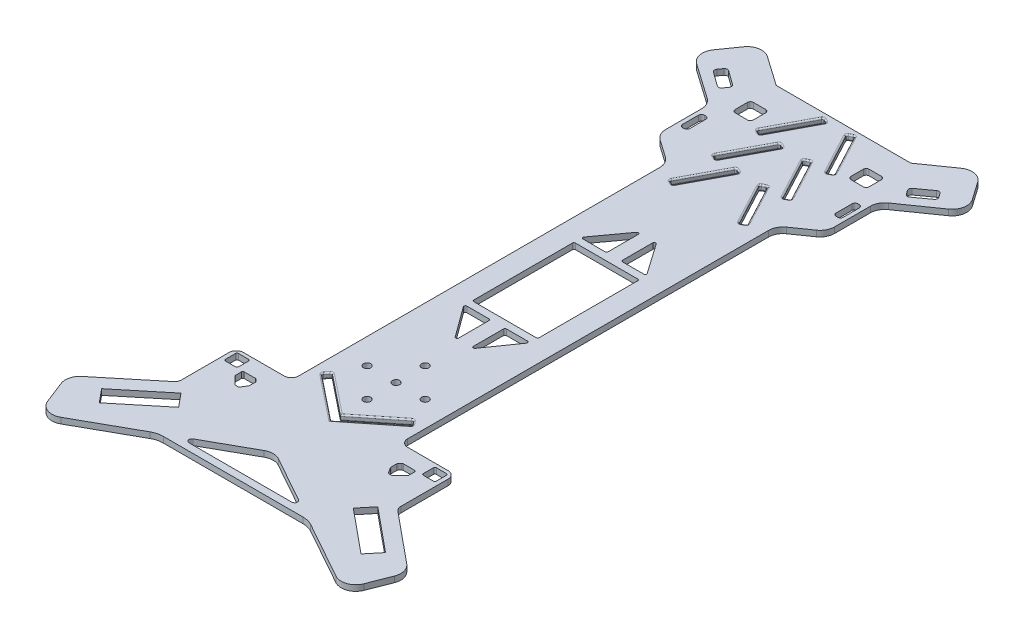
from build123d import *

# Parameters (mm, degrees)
SKETCH2_R           = 2.5
BOSS_EXTRUDE1_DEPTH = 4
FILLET1_R           = 1
CUT_EXTRUDE1_DEPTH  = 383.875992858
FILLET3_R           = 1


with BuildPart() as part:
    # Sketch2 → Boss-Extrude1 (new body)
    with BuildSketch(Plane(origin=(0, 0, 0), x_dir=(1, 0, 0), z_dir=(0, 1, 0))):
        with BuildLine():
            Line((-46.361864593, 80.672065662), (46.361864593, 80.672065662))
            Line((46.361864593, 80.672065662), (66.733304285, 94.936301299))
            ThreePointArc((66.733304285, 94.936301299), (74.205550425, 96.592858386), (80.660589091, 92.480545219))
            Line((80.660589091, 92.480545219), (89.264235636, 80.193264555))
            ThreePointArc((89.264235636, 80.193264555), (90.920792724, 72.721018415), (86.808479557, 66.265979749))
            Line((86.808479557, 66.265979749), (62.402393643, 49.176654414))
            ThreePointArc((62.402393643, 49.176654414), (59.268049675, 45.602620103), (58.138158007, 40.985133971))
            Line((58.138158007, 40.985133971), (58.138158007, 16.396474982))
            ThreePointArc((58.138158007, 16.396474982), (57.008266339, 11.77898885), (53.873922371, 8.204954539))
            Line((53.873922371, 8.204954539), (41.764235636, -0.274339397))
            ThreePointArc((41.764235636, -0.274339397), (38.629891668, -3.848373708), (37.5, -8.46585984))
            Line((37.5, -8.46585984), (37.5, -257.191548927))
            ThreePointArc((37.5, -257.191548927), (38.964466094, -260.727082833), (42.5, -262.191548927))
            Line((42.5, -262.191548927), (70.5, -262.191548927))
            ThreePointArc((70.5, -262.191548927), (74.035533906, -263.656015021), (75.5, -267.191548927))
            Line((75.5, -267.191548927), (75.5, -299.829610513))
            ThreePointArc((75.5, -299.829610513), (75.979045641, -301.965253667), (77.324388672, -303.691668603))
            Line((77.324388672, -303.691668603), (111.897825306, -332.119981805))
            ThreePointArc((111.897825306, -332.119981805), (115.222893786, -337.320332967), (114.861321217, -343.482231854))
            Line((114.861321217, -343.482231854), (108.940668871, -358.640885258))
            ThreePointArc((108.940668871, -358.640885258), (103.003554679, -364.415072502), (94.749722622, -363.73329568))
            Line((94.749722622, -363.73329568), (55.387093972, -341.748281553))
            ThreePointArc((55.387093972, -341.748281553), (51.851823332, -340.327947558), (48.072752447, -339.844097986))
            Line((48.072752447, -339.844097986), (-48.072752447, -339.844097986))
            ThreePointArc((-48.072752447, -339.844097986), (-51.851823332, -340.327947558), (-55.387093972, -341.748281553))
            Line((-55.387093972, -341.748281553), (-94.749722622, -363.73329568))
            ThreePointArc((-94.749722622, -363.73329568), (-103.003554679, -364.415072502), (-108.940668871, -358.640885258))
            Line((-108.940668871, -358.640885258), (-114.861321217, -343.482231854))
            ThreePointArc((-114.861321217, -343.482231854), (-115.222893786, -337.320332967), (-111.897825306, -332.119981805))
            Line((-111.897825306, -332.119981805), (-77.324388672, -303.691668603))
            ThreePointArc((-77.324388672, -303.691668603), (-75.979045641, -301.965253667), (-75.5, -299.829610513))
            Line((-75.5, -299.829610513), (-75.5, -267.191548927))
            ThreePointArc((-75.5, -267.191548927), (-74.035533906, -263.656015021), (-70.5, -262.191548927))
            Line((-70.5, -262.191548927), (-42.5, -262.191548927))
            ThreePointArc((-42.5, -262.191548927), (-38.964466094, -260.727082833), (-37.5, -257.191548927))
            Line((-37.5, -257.191548927), (-37.5, -8.46585984))
            ThreePointArc((-37.5, -8.46585984), (-38.629891668, -3.848373708), (-41.764235636, -0.274339397))
            Line((-41.764235636, -0.274339397), (-53.873922371, 8.204954539))
            ThreePointArc((-53.873922371, 8.204954539), (-57.008266339, 11.77898885), (-58.138158007, 16.396474982))
            Line((-58.138158007, 16.396474982), (-58.138158007, 40.985133971))
            ThreePointArc((-58.138158007, 40.985133971), (-59.268049675, 45.602620103), (-62.402393643, 49.176654414))
            Line((-62.402393643, 49.176654414), (-86.808479557, 66.265979749))
            ThreePointArc((-86.808479557, 66.265979749), (-90.920792724, 72.721018415), (-89.264235636, 80.193264555))
            Line((-89.264235636, 80.193264555), (-80.660589091, 92.480545219))
            ThreePointArc((-80.660589091, 92.480545219), (-74.205550425, 96.592858386), (-66.733304285, 94.936301299))
            Line((-66.733304285, 94.936301299), (-46.361864593, 80.672065662))
        make_face()
        with Locations((0, -227.537934338)):
            Circle(SKETCH2_R, mode=Mode.SUBTRACT)
        with Locations((0, -207.537934338)):
            Circle(SKETCH2_R, mode=Mode.SUBTRACT)
        with Locations((20, -227.537934338)):
            Circle(SKETCH2_R, mode=Mode.SUBTRACT)
        with Locations((-20, -227.537934338)):
            Circle(SKETCH2_R, mode=Mode.SUBTRACT)
        with Locations((0, -247.537934338)):
            Circle(SKETCH2_R, mode=Mode.SUBTRACT)
        with BuildLine():
            Line((-22.090719425, -159.127571831), (-6.807668017, -180.061844097))
            ThreePointArc((-6.807668017, -180.061844097), (-5.689893581, -180.422908454), (-5, -179.472206603))
            Line((-5, -179.472206603), (-5, -158.537934338))
            ThreePointArc((-5, -158.537934338), (-5.292893219, -157.830827556), (-6, -157.537934338))
            Line((-6, -157.537934338), (-21.283051408, -157.537934338))
            ThreePointArc((-21.283051408, -157.537934338), (-22.174577485, -158.084964964), (-22.090719425, -159.127571831))
        make_face(mode=Mode.SUBTRACT)
        with BuildLine():
            Line((-21.5, -152.537934338), (21.5, -152.537934338))
            ThreePointArc((21.5, -152.537934338), (22.207106781, -152.245041119), (22.5, -151.537934338))
            Line((22.5, -151.537934338), (22.5, -83.537934338))
            ThreePointArc((22.5, -83.537934338), (22.207106781, -82.830827556), (21.5, -82.537934338))
            Line((21.5, -82.537934338), (-21.5, -82.537934338))
            ThreePointArc((-21.5, -82.537934338), (-22.207106781, -82.830827556), (-22.5, -83.537934338))
            Line((-22.5, -83.537934338), (-22.5, -151.537934338))
            ThreePointArc((-22.5, -151.537934338), (-22.207106781, -152.245041119), (-21.5, -152.537934338))
        make_face(mode=Mode.SUBTRACT)
        with BuildLine():
            Line((5, -179.36556925), (5, -158.537934338))
            ThreePointArc((5, -158.537934338), (5.292893219, -157.830827556), (6, -157.537934338))
            Line((6, -157.537934338), (20.579344438, -157.537934338))
            ThreePointArc((20.579344438, -157.537934338), (21.466323115, -158.076123957), (21.398576359, -159.111396682))
            Line((21.398576359, -159.111396682), (6.819231921, -179.939031594))
            ThreePointArc((6.819231921, -179.939031594), (5.699360615, -180.319307138), (5, -179.36556925))
        make_face(mode=Mode.SUBTRACT)
        with BuildLine():
            Line((21.398576359, -75.964471993), (6.819231921, -55.136837081))
            ThreePointArc((6.819231921, -55.136837081), (5.699360615, -54.756561537), (5, -55.710299426))
            Line((5, -55.710299426), (5, -76.537934338))
            ThreePointArc((5, -76.537934338), (5.292893219, -77.245041119), (6, -77.537934338))
            Line((6, -77.537934338), (20.579344438, -77.537934338))
            ThreePointArc((20.579344438, -77.537934338), (21.466323115, -76.999744718), (21.398576359, -75.964471993))
        make_face(mode=Mode.SUBTRACT)
        with BuildLine():
            Line((-5, -55.603662072), (-5, -76.537934338))
            ThreePointArc((-5, -76.537934338), (-5.292893219, -77.245041119), (-6, -77.537934338))
            Line((-6, -77.537934338), (-21.283051408, -77.537934338))
            ThreePointArc((-21.283051408, -77.537934338), (-22.174577485, -76.990903711), (-22.090719425, -75.948296844))
            Line((-22.090719425, -75.948296844), (-6.807668017, -55.014024578))
            ThreePointArc((-6.807668017, -55.014024578), (-5.689893581, -54.652960221), (-5, -55.603662072))
        make_face(mode=Mode.SUBTRACT)
        with BuildLine():
            Line((-35.343245463, -334.844097986), (35.343245463, -334.844097986))
            ThreePointArc((35.343245463, -334.844097986), (37.278732187, -333.347974104), (36.318491, -331.097989129))
            Line((36.318491, -331.097989129), (4.876227684, -313.536697444))
            ThreePointArc((4.876227684, -313.536697444), (0, -312.267241733), (-4.876227684, -313.536697444))
            Line((-4.876227684, -313.536697444), (-36.318491, -331.097989129))
            ThreePointArc((-36.318491, -331.097989129), (-37.278732187, -333.347974104), (-35.343245463, -334.844097986))
        make_face(mode=Mode.SUBTRACT)
        Polygon((-97.800117755, -332.627217458), (-67.800117755, -307.959452865), (-60.178650569, -317.228392283), (-90.178650569, -341.896156876), align=None, mode=Mode.SUBTRACT)
        Polygon((60.178650569, -317.228392283), (90.178650569, -341.896156876), (97.800117755, -332.627217458), (67.800117755, -307.959452865), align=None, mode=Mode.SUBTRACT)
        Polygon((0, -272.537934338), (-31.268619197, -247.59252487), (-28.077508095, -243.59252487), (0, -265.992136821), (28.077508095, -243.59252487), (31.268619197, -247.59252487), align=None, mode=Mode.SUBTRACT)
        with BuildLine():
            Line((-59.382199075, -279.292595345), (-54.467985513, -284.206808907))
            ThreePointArc((-54.467985513, -284.206808907), (-54.143562164, -284.423581658), (-53.760878732, -284.499702126))
            Line((-53.760878732, -284.499702126), (-51.985926911, -284.499702126))
            ThreePointArc((-51.985926911, -284.499702126), (-51.496769477, -284.371897634), (-51.132645078, -284.021152135))
            Line((-51.132645078, -284.021152135), (-48.82181046, -280.239786398))
            ThreePointArc((-48.82181046, -280.239786398), (-48.712470397, -279.989185208), (-48.675092294, -279.718336389))
            Line((-48.675092294, -279.718336389), (-48.675092294, -275.913915688))
            ThreePointArc((-48.675092294, -275.913915688), (-48.751212762, -275.531232256), (-48.967985513, -275.206808907))
            Line((-48.967985513, -275.206808907), (-50.382199075, -273.792595345))
            ThreePointArc((-50.382199075, -273.792595345), (-50.706622424, -273.575822593), (-51.089305857, -273.499702126))
            Line((-51.089305857, -273.499702126), (-58.675092294, -273.499702126))
            ThreePointArc((-58.675092294, -273.499702126), (-59.382199075, -273.792595345), (-59.675092294, -274.499702126))
            Line((-59.675092294, -274.499702126), (-59.675092294, -278.585488563))
            ThreePointArc((-59.675092294, -278.585488563), (-59.598971827, -278.968171996), (-59.382199075, -279.292595345))
        make_face(mode=Mode.SUBTRACT)
        with BuildLine():
            Line((-71.669966165, -273.499702126), (-64.669966165, -273.499702126))
            ThreePointArc((-64.669966165, -273.499702126), (-63.962859384, -273.206808907), (-63.669966165, -272.499702126))
            Line((-63.669966165, -272.499702126), (-63.669966165, -265.499702126))
            ThreePointArc((-63.669966165, -265.499702126), (-63.962859384, -264.792595345), (-64.669966165, -264.499702126))
            Line((-64.669966165, -264.499702126), (-71.669966165, -264.499702126))
            ThreePointArc((-71.669966165, -264.499702126), (-72.377072946, -264.792595345), (-72.669966165, -265.499702126))
            Line((-72.669966165, -265.499702126), (-72.669966165, -272.499702126))
            ThreePointArc((-72.669966165, -272.499702126), (-72.377072946, -273.206808907), (-71.669966165, -273.499702126))
        make_face(mode=Mode.SUBTRACT)
        with BuildLine():
            Line((71.669966165, -264.499702126), (64.669966165, -264.499702126))
            ThreePointArc((64.669966165, -264.499702126), (63.962859384, -264.792595345), (63.669966165, -265.499702126))
            Line((63.669966165, -265.499702126), (63.669966165, -272.499702126))
            ThreePointArc((63.669966165, -272.499702126), (63.962859384, -273.206808907), (64.669966165, -273.499702126))
            Line((64.669966165, -273.499702126), (71.669966165, -273.499702126))
            ThreePointArc((71.669966165, -273.499702126), (72.377072946, -273.206808907), (72.669966165, -272.499702126))
            Line((72.669966165, -272.499702126), (72.669966165, -265.499702126))
            ThreePointArc((72.669966165, -265.499702126), (72.377072946, -264.792595345), (71.669966165, -264.499702126))
        make_face(mode=Mode.SUBTRACT)
        with BuildLine():
            Line((59.382199075, -279.292595345), (54.467985513, -284.206808907))
            ThreePointArc((54.467985513, -284.206808907), (54.143562164, -284.423581658), (53.760878732, -284.499702126))
            Line((53.760878732, -284.499702126), (51.985926911, -284.499702126))
            ThreePointArc((51.985926911, -284.499702126), (51.496769477, -284.371897634), (51.132645078, -284.021152135))
            Line((51.132645078, -284.021152135), (48.82181046, -280.239786398))
            ThreePointArc((48.82181046, -280.239786398), (48.712470397, -279.989185208), (48.675092294, -279.718336389))
            Line((48.675092294, -279.718336389), (48.675092294, -275.913915688))
            ThreePointArc((48.675092294, -275.913915688), (48.751212762, -275.531232256), (48.967985513, -275.206808907))
            Line((48.967985513, -275.206808907), (50.382199075, -273.792595345))
            ThreePointArc((50.382199075, -273.792595345), (50.706622424, -273.575822593), (51.089305857, -273.499702126))
            Line((51.089305857, -273.499702126), (58.675092294, -273.499702126))
            ThreePointArc((58.675092294, -273.499702126), (59.382199075, -273.792595345), (59.675092294, -274.499702126))
            Line((59.675092294, -274.499702126), (59.675092294, -278.585488563))
            ThreePointArc((59.675092294, -278.585488563), (59.598971827, -278.968171996), (59.382199075, -279.292595345))
        make_face(mode=Mode.SUBTRACT)
        with BuildLine():
            Line((-76.017703763, 67.061440836), (-66.288460673, 60.037066921))
            ThreePointArc((-66.288460673, 60.037066921), (-64.798959798, 59.684174737), (-63.496191172, 60.48787845))
            Line((-63.496191172, 60.48787845), (-61.447415447, 63.325574351))
            ThreePointArc((-61.447415447, 63.325574351), (-61.094523263, 64.815075227), (-61.898226976, 66.117843852))
            Line((-61.898226976, 66.117843852), (-71.627470066, 73.142217767))
            ThreePointArc((-71.627470066, 73.142217767), (-73.116970941, 73.495109951), (-74.419739567, 72.691406238))
            Line((-74.419739567, 72.691406238), (-76.468515292, 69.853710337))
            ThreePointArc((-76.468515292, 69.853710337), (-76.821407476, 68.364209461), (-76.017703763, 67.061440836))
        make_face(mode=Mode.SUBTRACT)
        with BuildLine():
            Line((63.496191172, 60.48787845), (61.447415447, 63.325574351))
            ThreePointArc((61.447415447, 63.325574351), (61.094523263, 64.815075227), (61.898226976, 66.117843852))
            Line((61.898226976, 66.117843852), (71.627470066, 73.142217767))
            ThreePointArc((71.627470066, 73.142217767), (73.116970941, 73.495109951), (74.419739567, 72.691406238))
            Line((74.419739567, 72.691406238), (76.468515292, 69.853710337))
            ThreePointArc((76.468515292, 69.853710337), (76.821407476, 68.364209461), (76.017703763, 67.061440836))
            Line((76.017703763, 67.061440836), (66.288460673, 60.037066921))
            ThreePointArc((66.288460673, 60.037066921), (64.798959798, 59.684174737), (63.496191172, 60.48787845))
        make_face(mode=Mode.SUBTRACT)
    extrude(amount=BOSS_EXTRUDE1_DEPTH)

    # Fillet1
    fillet1_edges = [part.edges().sort_by_distance(p)[0] for p in [
        (14.038754048, 4, 254.792330846),
        (14.038754048, 0, 254.792330846),
        (15.634309599, 4, 260.065229604),
        (15.634309599, 0, 260.065229604),
        (-15.634309599, 4, 260.065229604),
        (-15.634309599, 0, 260.065229604),
        (-14.038754048, 4, 254.792330846),
        (-14.038754048, 0, 254.792330846),
        (28.077508095, 2, 243.59252487),
        (29.673063646, 4, 245.59252487),
        (31.268619197, 2, 247.59252487),
        (29.673063646, 0, 245.59252487),
        (-31.268619197, 2, 247.59252487),
        (-29.673063646, 4, 245.59252487),
        (-28.077508095, 2, 243.59252487),
        (-29.673063646, 0, 245.59252487),
    ]]
    fillet(fillet1_edges, radius=FILLET1_R)

    # Sketch6 → Cut-Extrude1 (cut, through all)
    with BuildSketch(Plane(origin=(0, 4, 0), x_dir=(1, 0, 0), z_dir=(0, 1, 0))):
        Polygon((-22.95128295, -14.327934338), (-7, 15.672065662), (-10.796674649, 17.690793382), (-26.747957599, -12.309206618), align=None)
        Polygon((26.747957599, -12.309206618), (10.796674649, 17.690793382), (7, 15.672065662), (22.95128295, -14.327934338), align=None)
        Polygon((-22.95128295, 15.672065662), (-7, 45.672065662), (-10.796674649, 47.690793382), (-26.747957599, 17.690793382), align=None)
        Polygon((26.747957599, 17.690793382), (10.796674649, 47.690793382), (7, 45.672065662), (22.95128295, 15.672065662), align=None)
        Polygon((-22.95128295, 45.672065662), (-7, 75.672065662), (-10.796674649, 77.690793382), (-26.747957599, 47.690793382), align=None)
        Polygon((26.747957599, 47.690793382), (10.796674649, 77.690793382), (7, 75.672065662), (22.95128295, 45.672065662), align=None)
        with BuildLine():
            Line((-53.388158007, 38.172065662), (-52.388158007, 38.172065662))
            ThreePointArc((-52.388158007, 38.172065662), (-50.973944445, 37.586279225), (-50.388158007, 36.172065662))
            Line((-50.388158007, 36.172065662), (-50.388158007, 25.172065662))
            ThreePointArc((-50.388158007, 25.172065662), (-50.973944445, 23.7578521), (-52.388158007, 23.172065662))
            Line((-52.388158007, 23.172065662), (-53.388158007, 23.172065662))
            ThreePointArc((-53.388158007, 23.172065662), (-54.802371569, 23.7578521), (-55.388158007, 25.172065662))
            Line((-55.388158007, 25.172065662), (-55.388158007, 36.172065662))
            ThreePointArc((-55.388158007, 36.172065662), (-54.802371569, 37.586279225), (-53.388158007, 38.172065662))
        make_face()
        with BuildLine():
            Line((53.388158007, 23.172065662), (52.388158007, 23.172065662))
            ThreePointArc((52.388158007, 23.172065662), (50.973944445, 23.7578521), (50.388158007, 25.172065662))
            Line((50.388158007, 25.172065662), (50.388158007, 36.172065662))
            ThreePointArc((50.388158007, 36.172065662), (50.973944445, 37.586279225), (52.388158007, 38.172065662))
            Line((52.388158007, 38.172065662), (53.388158007, 38.172065662))
            ThreePointArc((53.388158007, 38.172065662), (54.802371569, 37.586279225), (55.388158007, 36.172065662))
            Line((55.388158007, 36.172065662), (55.388158007, 25.172065662))
            ThreePointArc((55.388158007, 25.172065662), (54.802371569, 23.7578521), (53.388158007, 23.172065662))
        make_face()
        with BuildLine():
            Line((-44.138158007, 50.172065662), (-35.638158007, 50.172065662))
            ThreePointArc((-35.638158007, 50.172065662), (-34.223944445, 50.7578521), (-33.638158007, 52.172065662))
            Line((-33.638158007, 52.172065662), (-33.638158007, 60.672065662))
            ThreePointArc((-33.638158007, 60.672065662), (-34.223944445, 62.086279225), (-35.638158007, 62.672065662))
            Line((-35.638158007, 62.672065662), (-44.138158007, 62.672065662))
            ThreePointArc((-44.138158007, 62.672065662), (-45.552371569, 62.086279225), (-46.138158007, 60.672065662))
            Line((-46.138158007, 60.672065662), (-46.138158007, 52.172065662))
            ThreePointArc((-46.138158007, 52.172065662), (-45.552371569, 50.7578521), (-44.138158007, 50.172065662))
        make_face()
        with BuildLine():
            Line((33.638158007, 52.172065662), (33.638158007, 60.672065662))
            ThreePointArc((33.638158007, 60.672065662), (34.223944445, 62.086279225), (35.638158007, 62.672065662))
            Line((35.638158007, 62.672065662), (44.138158007, 62.672065662))
            ThreePointArc((44.138158007, 62.672065662), (45.552371569, 62.086279225), (46.138158007, 60.672065662))
            Line((46.138158007, 60.672065662), (46.138158007, 52.172065662))
            ThreePointArc((46.138158007, 52.172065662), (45.552371569, 50.7578521), (44.138158007, 50.172065662))
            Line((44.138158007, 50.172065662), (35.638158007, 50.172065662))
            ThreePointArc((35.638158007, 50.172065662), (34.223944445, 50.7578521), (33.638158007, 52.172065662))
        make_face()
    extrude(amount=-CUT_EXTRUDE1_DEPTH, mode=Mode.SUBTRACT)

    # Fillet3
    fillet3_edges = [part.edges().sort_by_distance(p)[0] for p in [
        (18.772316124, 0, -62.690793382),
        (18.772316124, 4, -62.690793382),
        (14.975641475, 0, -60.672065662),
        (14.975641475, 4, -60.672065662),
        (-14.975641475, 0, -60.672065662),
        (-14.975641475, 4, -60.672065662),
        (-18.772316124, 0, -62.690793382),
        (-18.772316124, 4, -62.690793382),
        (-14.975641475, 0, -30.672065662),
        (-14.975641475, 4, -30.672065662),
        (-18.772316124, 0, -32.690793382),
        (-18.772316124, 4, -32.690793382),
        (14.975641475, 0, -30.672065662),
        (14.975641475, 4, -30.672065662),
        (18.772316124, 0, -32.690793382),
        (18.772316124, 4, -32.690793382),
        (18.772316124, 0, -2.690793382),
        (18.772316124, 4, -2.690793382),
        (14.975641475, 0, -0.672065662),
        (14.975641475, 4, -0.672065662),
        (-14.975641475, 0, -0.672065662),
        (-14.975641475, 4, -0.672065662),
        (-18.772316124, 0, -2.690793382),
        (-18.772316124, 4, -2.690793382),
        (22.95128295, 2, -45.672065662),
        (24.849620274, 0, -46.681429522),
        (26.747957599, 2, -47.690793382),
        (24.849620274, 4, -46.681429522),
        (10.796674649, 2, -77.690793382),
        (8.898337325, 0, -76.681429522),
        (7, 2, -75.672065662),
        (8.898337325, 4, -76.681429522),
        (-26.747957599, 2, -47.690793382),
        (-24.849620274, 0, -46.681429522),
        (-22.95128295, 2, -45.672065662),
        (-24.849620274, 4, -46.681429522),
        (-7, 2, -75.672065662),
        (-8.898337325, 0, -76.681429522),
        (-10.796674649, 2, -77.690793382),
        (-8.898337325, 4, -76.681429522),
        (-26.747957599, 2, -17.690793382),
        (-24.849620274, 0, -16.681429522),
        (-22.95128295, 2, -15.672065662),
        (-24.849620274, 4, -16.681429522),
        (-7, 2, -45.672065662),
        (-8.898337325, 0, -46.681429522),
        (-10.796674649, 2, -47.690793382),
        (-8.898337325, 4, -46.681429522),
        (10.796674649, 2, -47.690793382),
        (8.898337325, 0, -46.681429522),
        (7, 2, -45.672065662),
        (8.898337325, 4, -46.681429522),
        (22.95128295, 2, -15.672065662),
        (24.849620274, 0, -16.681429522),
        (26.747957599, 2, -17.690793382),
        (24.849620274, 4, -16.681429522),
        (22.95128295, 2, 14.327934338),
        (24.849620274, 0, 13.318570478),
        (26.747957599, 2, 12.309206618),
        (24.849620274, 4, 13.318570478),
        (10.796674649, 2, -17.690793382),
        (8.898337325, 0, -16.681429522),
        (7, 2, -15.672065662),
        (8.898337325, 4, -16.681429522),
        (-26.747957599, 2, 12.309206618),
        (-24.849620274, 0, 13.318570478),
        (-22.95128295, 2, 14.327934338),
        (-24.849620274, 4, 13.318570478),
        (-7, 2, -15.672065662),
        (-8.898337325, 0, -16.681429522),
        (-10.796674649, 2, -17.690793382),
        (-8.898337325, 4, -16.681429522),
    ]]
    fillet(fillet3_edges, radius=FILLET3_R)


solid = part.part
